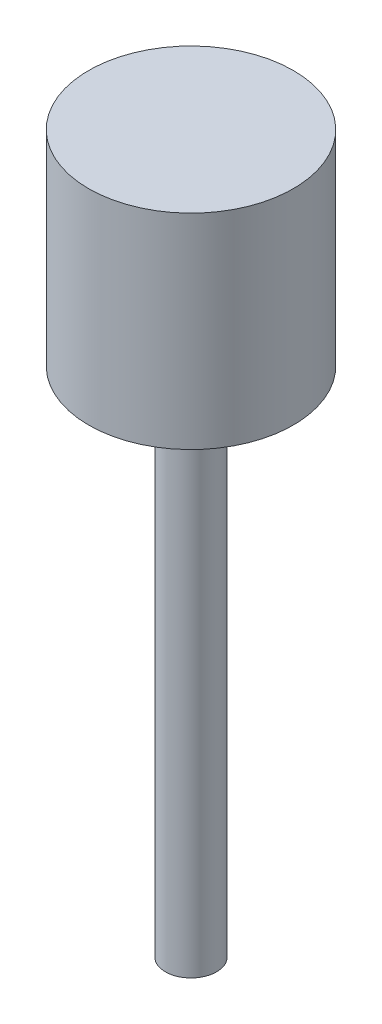
from build123d import *


with BuildPart() as part:
    # Esboço1 → Revolução1 (revolve)
    with BuildSketch(Plane.XY, mode=Mode.PRIVATE) as revolu_o1_sk:
        Polygon((0, 0), (0, 70), (10, 70), (10, 50), (2.5, 50), (2.5, 0), align=None)
    revolve(revolu_o1_sk.sketch.rotate(Axis((0, 0, 0), (0, 1, 0)), 90), axis=Axis((0, 0, 0), (0, 1, 0)))


solid = part.part
